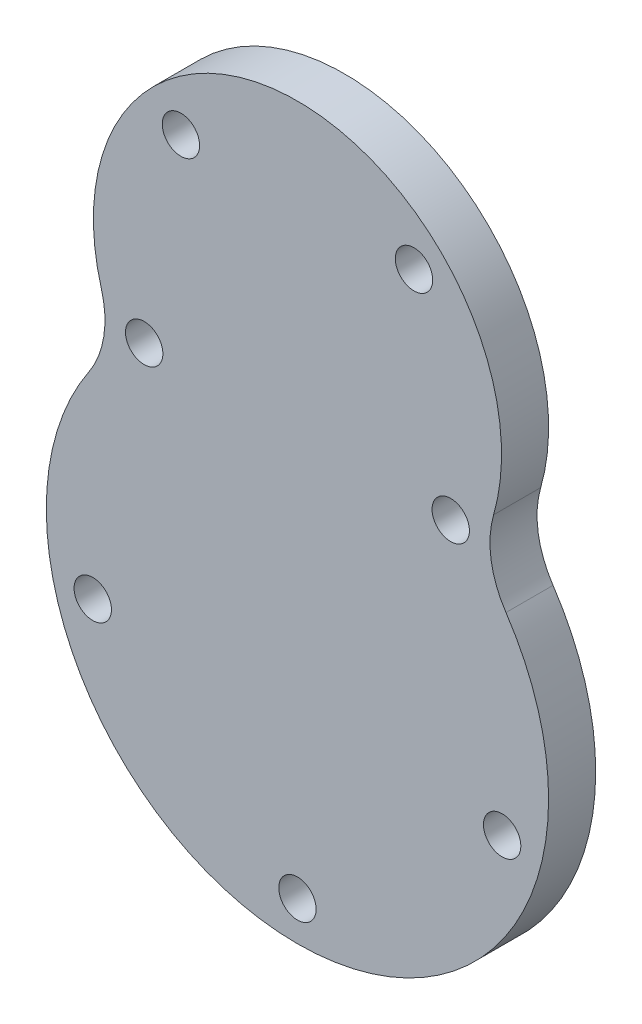
from build123d import *

# Parameters (mm, degrees)
RESSALTO_EXTRUS_O1_DEPTH = 6
ESBO_O2_R                = 2.38125
CORTE_EXTRUS_O1_DEPTH    = 75.491610266


with BuildPart() as part:
    # Esboço1 → Ressalto-extrusão1 (new body)
    with BuildSketch(Plane.XY):
        with BuildLine():
            ThreePointArc((24.993351584, -7.164661654), (0, 26), (-24.993351584, -7.164661654))
            ThreePointArc((-24.993351584, -7.164661654), (-24.67461016, -12.336769329), (-26.566359725, -17.161038961))
            ThreePointArc((-26.566359725, -17.161038961), (0, -67), (26.566359725, -17.161038961))
            ThreePointArc((26.566359725, -17.161038961), (24.67461016, -12.336769329), (24.993351584, -7.164661654))
        make_face()
    extrude(amount=RESSALTO_EXTRUS_O1_DEPTH)

    # Esboço2 → Corte-extrusão1 (cut, through all)
    with BuildSketch(Plane.XY.offset(6)):
        with Locations((-14.849242405, 14.849242405)):
            Circle(ESBO_O2_R)
        with Locations((-19.528744622, -10.471428571)):
            Circle(ESBO_O2_R)
        with Locations((14.849242405, 14.849242405)):
            Circle(ESBO_O2_R)
        with Locations((19.528744622, -10.471428571)):
            Circle(ESBO_O2_R)
        with Locations((-26.07999731, -41.988114218)):
            Circle(ESBO_O2_R)
        with Locations((0, -62)):
            Circle(ESBO_O2_R)
        with Locations((26.07999731, -41.988114218)):
            Circle(ESBO_O2_R)
    extrude(amount=-CORTE_EXTRUS_O1_DEPTH, mode=Mode.SUBTRACT)


solid = part.part
